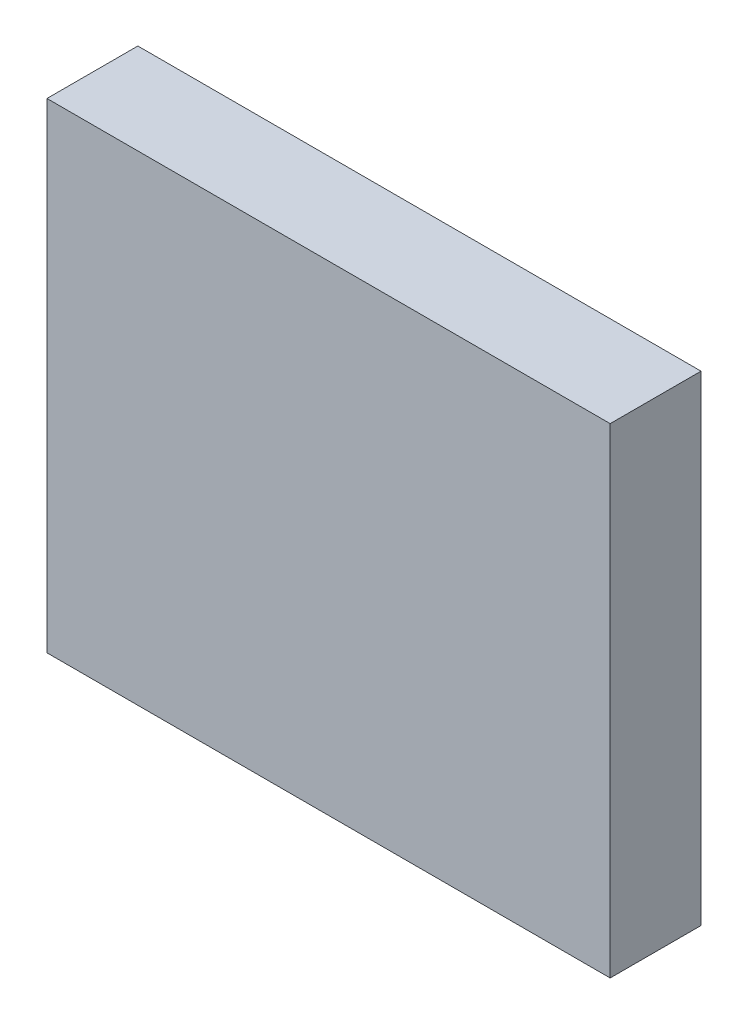
from build123d import *

# Parameters (mm, degrees)
SKETCH1_W               = 6.1976
SKETCH1_H               = 5.2832
COMPONENT_OUTLINE_DEPTH = 1


with BuildPart() as part:
    # Sketch1 → Component_Outline (new body)
    with BuildSketch(Plane.XY):
        Rectangle(SKETCH1_W, SKETCH1_H)
    extrude(amount=COMPONENT_OUTLINE_DEPTH)


solid = part.part
